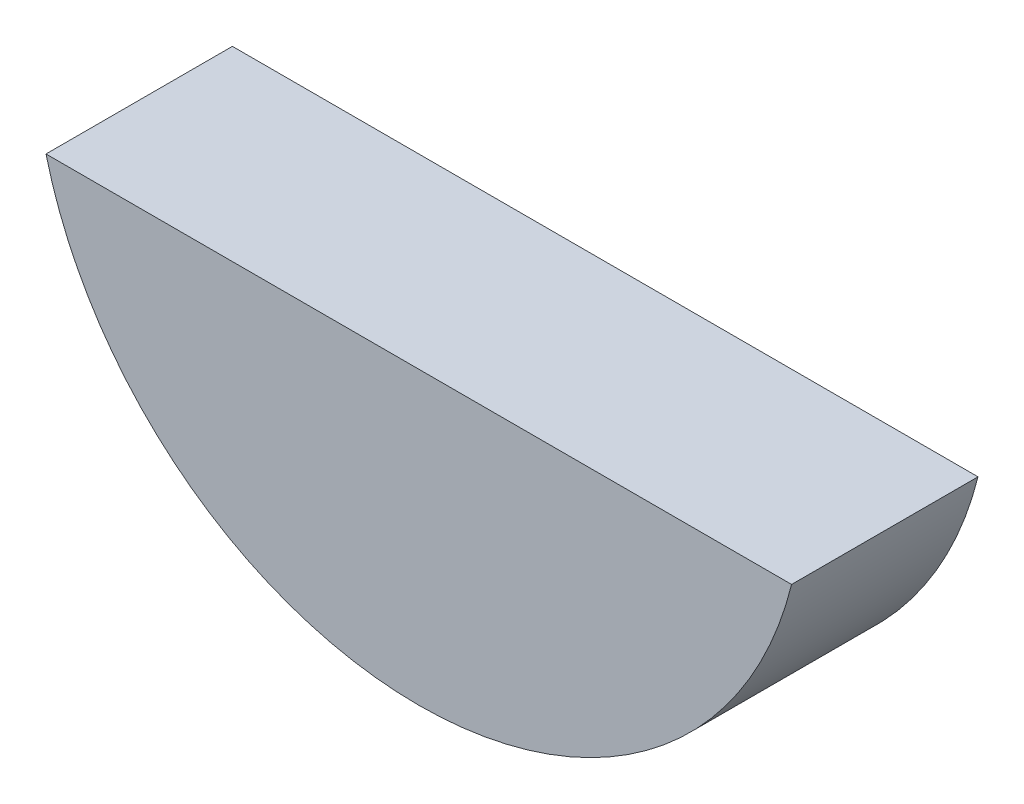
from build123d import *

# Parameters (mm, degrees)
BOSS_EXTRUDE1_DEPTH = 1


with BuildPart() as part:
    # Sketch1 → Boss-Extrude1 (new, symmetric)
    with BuildSketch(Plane.XY):
        with BuildLine():
            Line((-4, 0), (4, 0))
            ThreePointArc((4, 0), (0, -3.123105626), (-4, 0))
        make_face()
    extrude(amount=BOSS_EXTRUDE1_DEPTH, both=True)


solid = part.part
